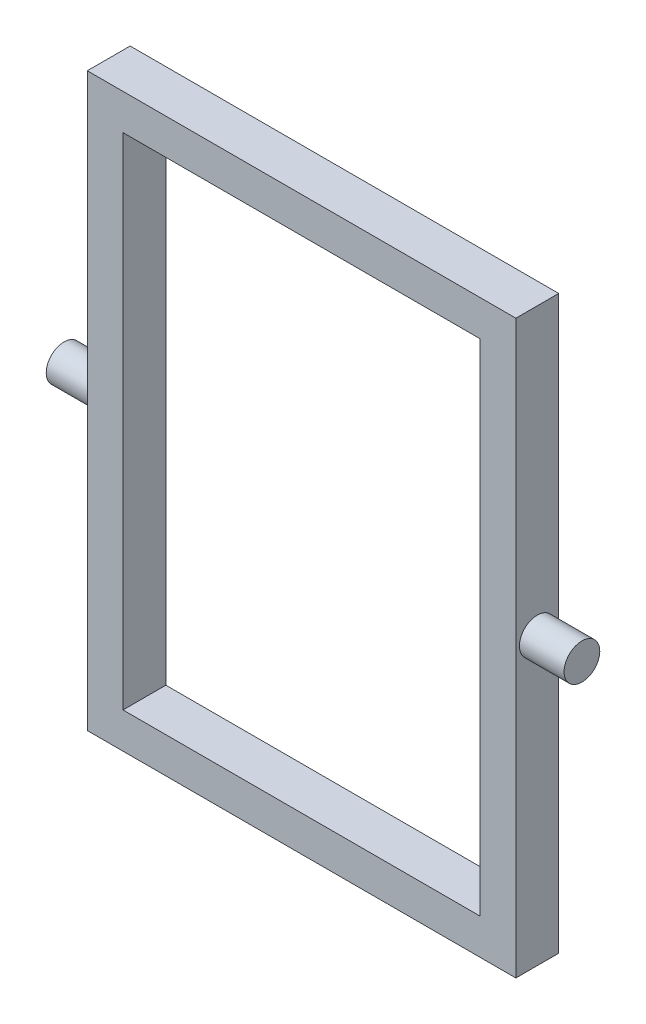
from build123d import *

# Parameters (mm, degrees)
BOSS_EXTRUDE1_DEPTH      = 30
BOSS_EXTRUDE1_DEPTH_BACK = 30
SKETCH2_W                = 600
SKETCH2_H                = 800
SKETCH2_W_2              = 500
SKETCH2_H_2              = 700
SKETCH3_R                = 25
BOSS_EXTRUDE2_DEPTH      = 62.5


with BuildPart() as part:
    # Sketch2 → Boss-Extrude1 (new, two sides: drawn at the far end of the back side and taken through both)
    with BuildSketch(Plane.XY.offset(-BOSS_EXTRUDE1_DEPTH_BACK)):
        Rectangle(SKETCH2_W, SKETCH2_H)
        Rectangle(SKETCH2_W_2, SKETCH2_H_2, mode=Mode.SUBTRACT)
    extrude(amount=BOSS_EXTRUDE1_DEPTH + BOSS_EXTRUDE1_DEPTH_BACK)

    # Sketch3 → Boss-Extrude2 (add)
    with BuildSketch(Plane(origin=(300, 0, 0), x_dir=(0, 0, -1), z_dir=(1, 0, 0))):
        Circle(SKETCH3_R)
    boss_extrude2 = extrude(amount=BOSS_EXTRUDE2_DEPTH)

    # Mirror1: Boss-Extrude2 across plane
    add(boss_extrude2.mirror(Plane(origin=(0, 0, 0), x_dir=(0, 0, 1), z_dir=(1, 0, 0))))


solid = part.part
